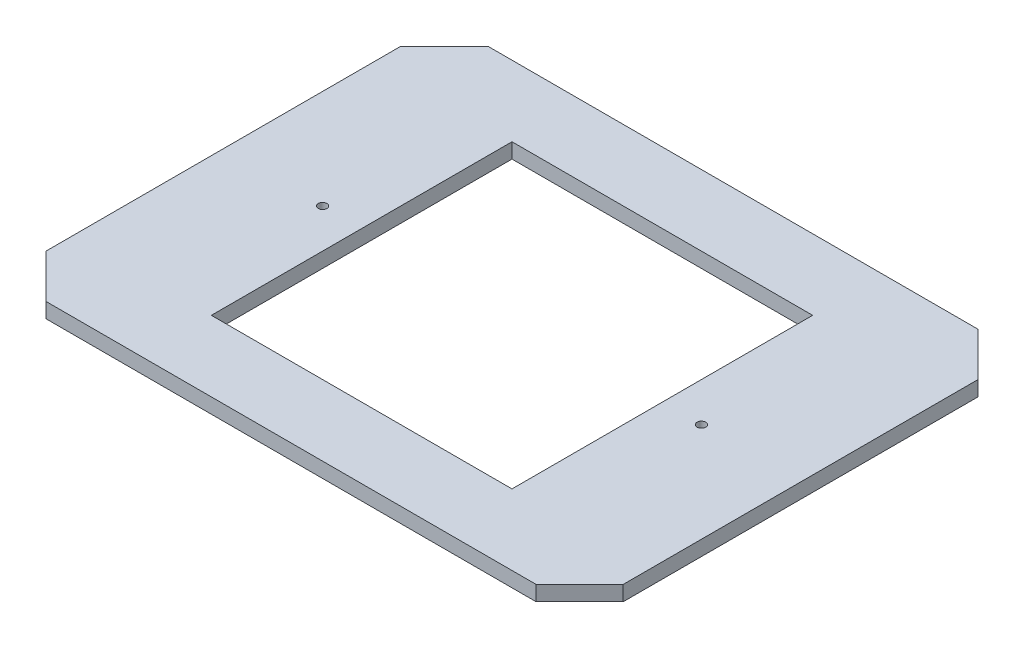
from build123d import *

# Parameters (mm, degrees)
CROQUIS1_R              = 1.45
CROQUIS1_W              = 100
CROQUIS1_H              = 100
SALIENTE_EXTRUIR1_DEPTH = 5


with BuildPart() as part:
    # Croquis1 → Saliente-Extruir1 (new body)
    with BuildSketch(Plane(origin=(0, 0, 0), x_dir=(1, 0, 0), z_dir=(0, 1, 0))):
        Polygon((0, 0), (-14.5, 14.5), (-14.5, 132.5), (0, 147), (163, 147), (177.5, 132.5), (177.5, 14.5), (163, 0), align=None)
        with Locations(Location((18.5, 73.5, 0), (0, 0, 270))):
            Circle(CROQUIS1_R, mode=Mode.SUBTRACT)
        with Locations(Location((144.5, 73.5, 0), (0, 0, 270))):
            Circle(CROQUIS1_R, mode=Mode.SUBTRACT)
        with Locations((81.5, 73.5)):
            Rectangle(CROQUIS1_W, CROQUIS1_H, mode=Mode.SUBTRACT)
    extrude(amount=SALIENTE_EXTRUIR1_DEPTH)


solid = part.part
